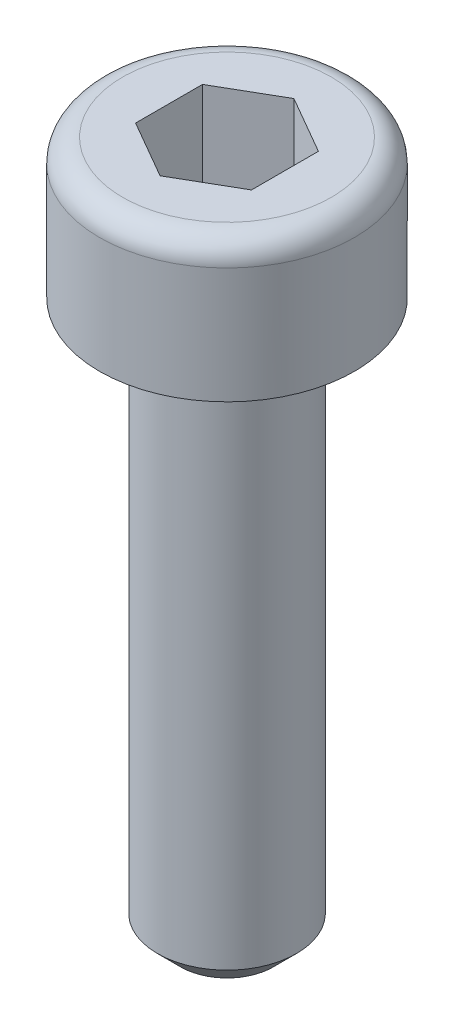
from build123d import *

# Parameters (mm, degrees)
CORTAR_EXTRUIR1_DEPTH = 2
CHAFL_N1_SIZE         = 0.5
REDONDEO1_R           = 0.5


with BuildPart() as part:
    # Croquis1 → Revolución1 (revolve)
    with BuildSketch(Plane.XY, mode=Mode.PRIVATE) as revoluci_n1_sk:
        Polygon((0, 0), (2.75, 0), (2.75, -3), (1.5, -3), (1.5, -15), (0, -15), align=None)
    revolve(revoluci_n1_sk.sketch.rotate(Axis((0, 0, 0), (0, -1, 0)), 90), axis=Axis((0, 0, 0), (0, -1, 0)))

    # Croquis2 → Cortar-Extruir1 (cut)
    with BuildSketch(Plane(origin=(0, 0, 0), x_dir=(1, 0, 0), z_dir=(0, 1, 0))):
        Polygon((1.25, 0.721687836), (0, 1.443375673), (-1.25, 0.721687836), (-1.25, -0.721687836), (0, -1.443375673), (1.25, -0.721687836), align=None)
    extrude(amount=-CORTAR_EXTRUIR1_DEPTH, mode=Mode.SUBTRACT)

    # Chaflán1
    chafl_n1_edges = [part.edges().sort_by_distance(p)[0] for p in [
        (0, -15, -1.5),
    ]]
    chamfer(chafl_n1_edges, length=CHAFL_N1_SIZE)

    # Redondeo1
    redondeo1_edges = [part.edges().sort_by_distance(p)[0] for p in [
        (0, 0, -2.75),
    ]]
    fillet(redondeo1_edges, radius=REDONDEO1_R)


solid = part.part
